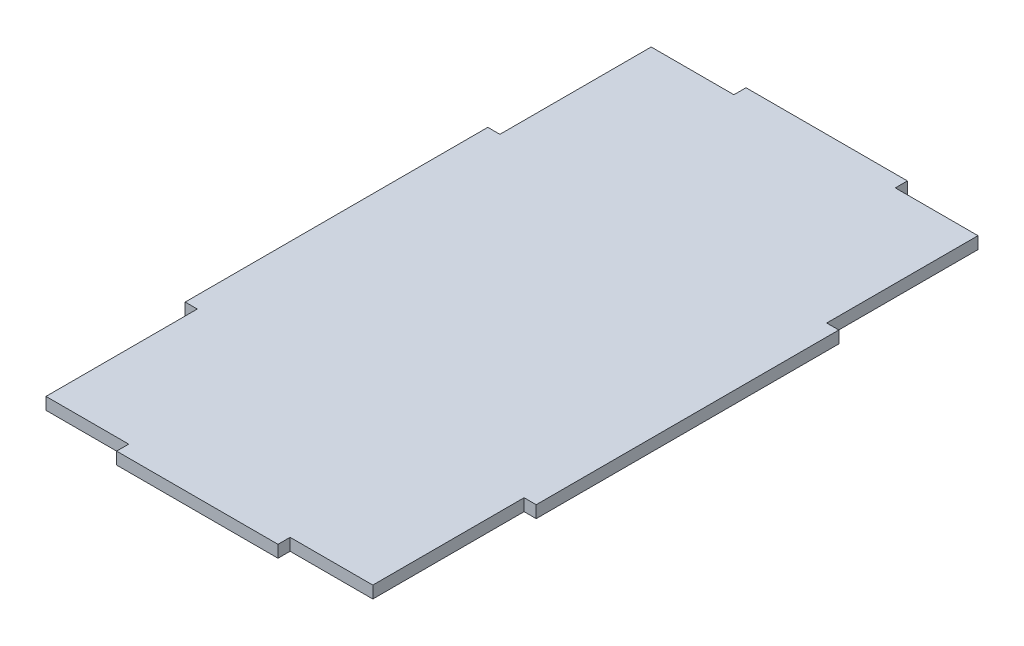
from build123d import *

# Parameters (mm, degrees)
SALIENTE_EXTRUIR1_DEPTH = 3


with BuildPart() as part:
    # Croquis1 → Saliente-Extruir1 (new body)
    with BuildSketch(Plane(origin=(0, 0, 0), x_dir=(1, 0, 0), z_dir=(0, 1, 0))):
        Polygon((0, 112.5), (0, 150), (20.5, 150), (20.5, 153), (60.5, 153), (60.5, 150), (81, 150), (81, 112.5), (84, 112.5), (84, 37.5), (81, 37.5), (81, 0), (60.5, 0), (60.5, -3), (20.5, -3), (20.5, 0), (0, 0), (0, 37.5), (-3, 37.5), (-3, 112.5), align=None)
    extrude(amount=SALIENTE_EXTRUIR1_DEPTH)


solid = part.part
